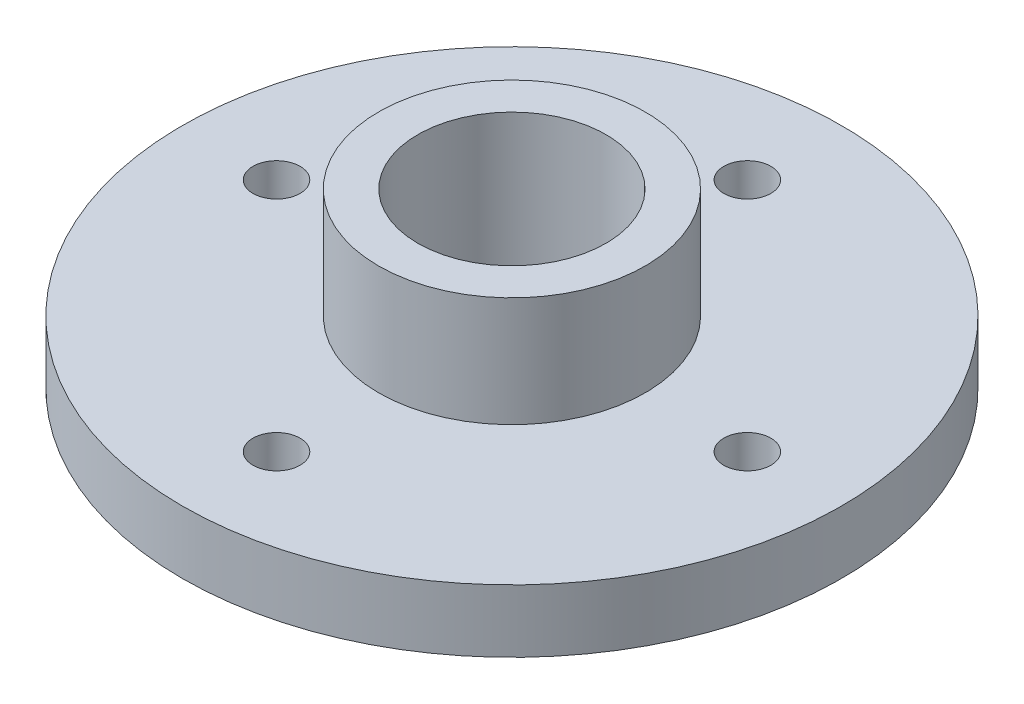
from build123d import *

# Parameters (mm, degrees)
SKIZZE1_R                       = 10.5
AUFSATZ_LINEAR_AUSTRAGEN1_DEPTH = 2
SKIZZE2_R                       = 4.25
SKIZZE2_R_2                     = 3
AUFSATZ_LINEAR_AUSTRAGEN2_DEPTH = 3.5
SKIZZE3_R                       = 0.75
SCHNITT_LINEAR_AUSTRAGEN1_DEPTH = 3.5
SCHNITT_LINEAR_START            = -3.5
SKIZZE4_R                       = 3
SCHNITT_LINEAR_AUSTRAGEN2_DEPTH = 3.5


with BuildPart() as part:
    # Skizze1 → Aufsatz-Linear austragen1 (new body)
    with BuildSketch(Plane(origin=(0, 0, 0), x_dir=(1, 0, 0), z_dir=(0, 1, 0))):
        with Locations(Location((0, 0, 0), (0, 0, 270))):
            Circle(SKIZZE1_R)
    extrude(amount=AUFSATZ_LINEAR_AUSTRAGEN1_DEPTH)

    # Skizze2 → Aufsatz-Linear austragen2 (add)
    with BuildSketch(Plane(origin=(0, 2, 0), x_dir=(1, 0, 0), z_dir=(0, 1, 0))):
        with Locations(Location((0, 0, 0), (0, 0, 270))):
            Circle(SKIZZE2_R)
        with Locations(Location((0, 0, 0), (0, 0, 270))):
            Circle(SKIZZE2_R_2, mode=Mode.SUBTRACT)
    extrude(amount=AUFSATZ_LINEAR_AUSTRAGEN2_DEPTH)

    # Skizze3 → Schnitt-Linear austragen1 (cut)
    with BuildSketch(Plane(origin=(0, 2, 0), x_dir=(1, 0, 0), z_dir=(0, 1, 0))):
        with Locations(Location((0, 7.5, 0), (0, 0, 270))):
            Circle(SKIZZE3_R)
        with Locations(Location((0, -7.5, 0), (0, 0, 270))):
            Circle(SKIZZE3_R)
        with Locations(Location((7.5, 0, 0), (0, 0, 270))):
            Circle(SKIZZE3_R)
        with Locations(Location((-7.5, 0, 0), (0, 0, 270))):
            Circle(SKIZZE3_R)
    extrude(amount=-SCHNITT_LINEAR_AUSTRAGEN1_DEPTH, mode=Mode.SUBTRACT)

    # Skizze4 → Schnitt-Linear austragen2 (cut)
    with BuildSketch(Plane(origin=(0, 2, 0), x_dir=(1, 0, 0), z_dir=(0, 1, 0)).offset(SCHNITT_LINEAR_START)):
        with Locations(Location((0, 0, 0), (0, 0, 270))):
            Circle(SKIZZE4_R)
    extrude(amount=SCHNITT_LINEAR_AUSTRAGEN2_DEPTH, mode=Mode.SUBTRACT)


solid = part.part
